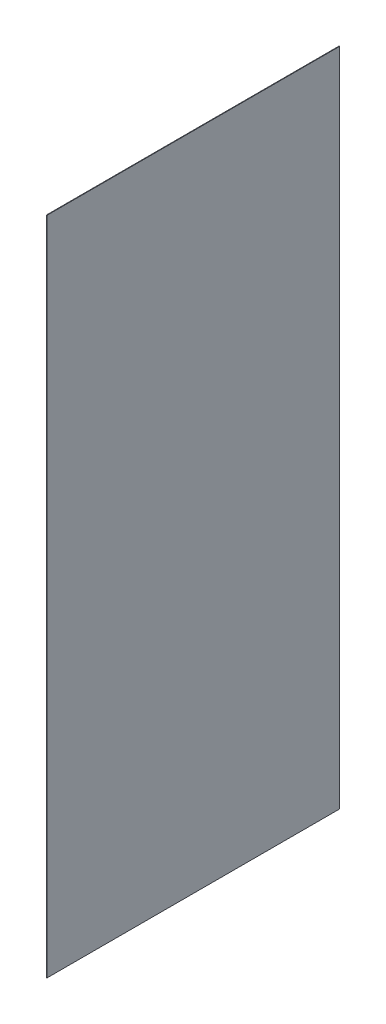
from build123d import *

# Parameters (mm, degrees)
SKETCH1_W                 = 1.5
SKETCH1_H                 = 1850
STORE_DIS_YAN_SOL_1_DEPTH = 820


with BuildPart() as part:
    # Sketch1 → STORE_dis_yan_sol_1 (new body)
    with BuildSketch(Plane.XY):
        with Locations((0.75, 1045)):
            Rectangle(SKETCH1_W, SKETCH1_H)
    extrude(amount=-STORE_DIS_YAN_SOL_1_DEPTH)


solid = part.part
